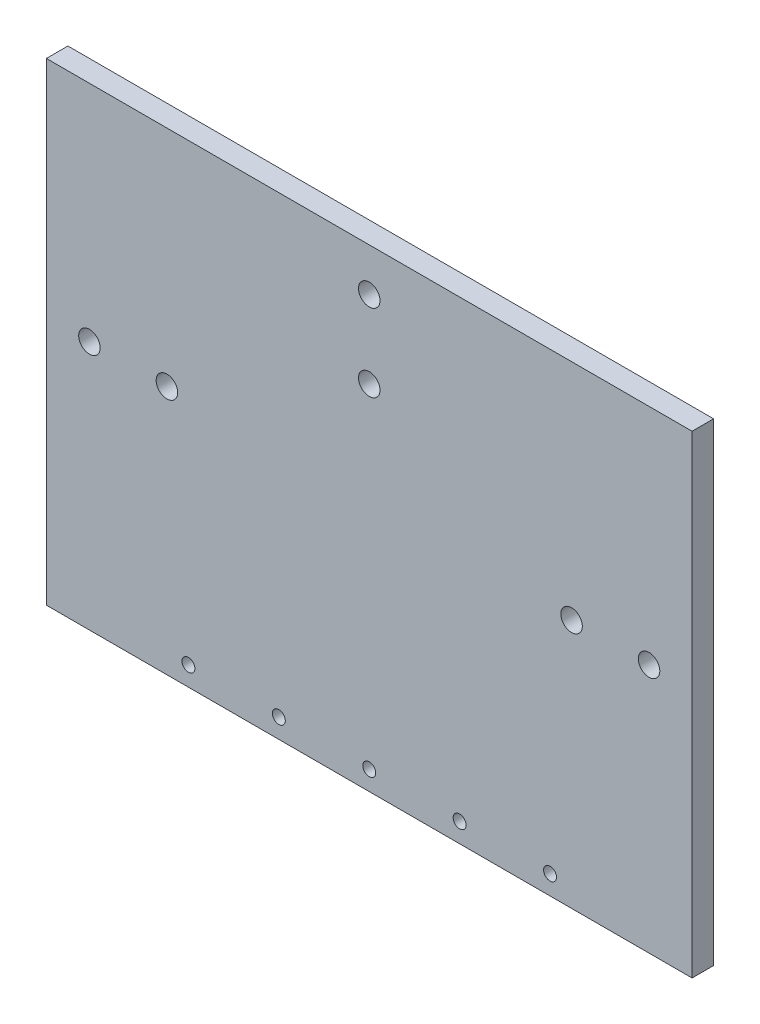
from build123d import *

# Parameters (mm, degrees)
SKETCH_1_W             = 150
SKETCH_1_H             = 110
EXTRUDE_1_DEPTH        = 5
CUT_EXTRUDE_1_REACH    = 95.14
SKETCH_2_R             = 1.5
PATTERN_LINEAR_1_COUNT = 5
PATTERN_LINEAR_1_PITCH = 21
CUT_EXTRUDE_2_REACH    = 95.14
SKETCH_3_R             = 2.5
CUT_EXTRUDE_3_REACH    = 95.14
SKETCH_4_R             = 2.5


with BuildPart() as part:
    # 草圖1 → 填料-伸長1 (new body)
    with BuildSketch(Plane.XY):
        Rectangle(SKETCH_1_W, SKETCH_1_H)
    extrude(amount=EXTRUDE_1_DEPTH)

    # 草圖2 → 除料-伸長1 (cut, up to next)
    with BuildSketch(Plane.XY.offset(5), mode=Mode.PRIVATE) as cut_extrude_1_sk1:
        with Locations((42, -50.5)):
            Circle(SKETCH_2_R)
    cut_extrude_1_tool1 = extrude(cut_extrude_1_sk1.sketch, amount=-CUT_EXTRUDE_1_REACH, mode=Mode.PRIVATE) & part.part
    cut_extrude_1 = cut_extrude_1_tool1.solids().sort_by_distance((42, -50.5, 5))[0]
    add(cut_extrude_1, mode=Mode.SUBTRACT)

    # 直線複製排列1: 除料-伸長1 ×5
    with Locations(*[(-i * PATTERN_LINEAR_1_PITCH, 0, 0) for i in range(1, PATTERN_LINEAR_1_COUNT)]):
        add(cut_extrude_1, mode=Mode.SUBTRACT)

    # 草圖3 → 除料-伸長2 (cut, up to next)
    with BuildSketch(Plane.XY.offset(5), mode=Mode.PRIVATE) as cut_extrude_2_sk1:
        with Locations((-65, 3)):
            Circle(SKETCH_3_R)
    cut_extrude_2_tool1 = extrude(cut_extrude_2_sk1.sketch, amount=-CUT_EXTRUDE_2_REACH, mode=Mode.PRIVATE) & part.part
    # 草圖3 → 除料-伸長2 (cut, up to next)
    with BuildSketch(Plane.XY.offset(5), mode=Mode.PRIVATE) as cut_extrude_2_sk2:
        with Locations((-47, 3)):
            Circle(SKETCH_3_R)
    cut_extrude_2_tool2 = extrude(cut_extrude_2_sk2.sketch, amount=-CUT_EXTRUDE_2_REACH, mode=Mode.PRIVATE) & part.part
    cut_extrude_2_1 = cut_extrude_2_tool1.solids().sort_by_distance((-65, 3, 5))[0]
    add(cut_extrude_2_1, mode=Mode.SUBTRACT)
    cut_extrude_2_2 = cut_extrude_2_tool2.solids().sort_by_distance((-47, 3, 5))[0]
    add(cut_extrude_2_2, mode=Mode.SUBTRACT)
    cut_extrude_2 = cut_extrude_2_1 + cut_extrude_2_2  # 除料-伸長2 as one shape, for the pattern or mirror that repeats it

    # 鏡射1: 除料-伸長2 across plane
    add(cut_extrude_2.mirror(Plane(origin=(0, 0, 0), x_dir=(0, 0, 1), z_dir=(1, 0, 0))), mode=Mode.SUBTRACT)

    # 草圖4 → 除料-伸長3 (cut, up to next)
    with BuildSketch(Plane.XY.offset(5), mode=Mode.PRIVATE) as cut_extrude_3_sk1:
        with Locations((0, 45)):
            Circle(SKETCH_4_R)
    cut_extrude_3_tool1 = extrude(cut_extrude_3_sk1.sketch, amount=-CUT_EXTRUDE_3_REACH, mode=Mode.PRIVATE) & part.part
    # 草圖4 → 除料-伸長3 (cut, up to next)
    with BuildSketch(Plane.XY.offset(5), mode=Mode.PRIVATE) as cut_extrude_3_sk2:
        with Locations((0, 27)):
            Circle(SKETCH_4_R)
    cut_extrude_3_tool2 = extrude(cut_extrude_3_sk2.sketch, amount=-CUT_EXTRUDE_3_REACH, mode=Mode.PRIVATE) & part.part
    add(cut_extrude_3_tool1.solids().sort_by_distance((0, 45, 5))[0], mode=Mode.SUBTRACT)
    add(cut_extrude_3_tool2.solids().sort_by_distance((0, 27, 5))[0], mode=Mode.SUBTRACT)


solid = part.part
